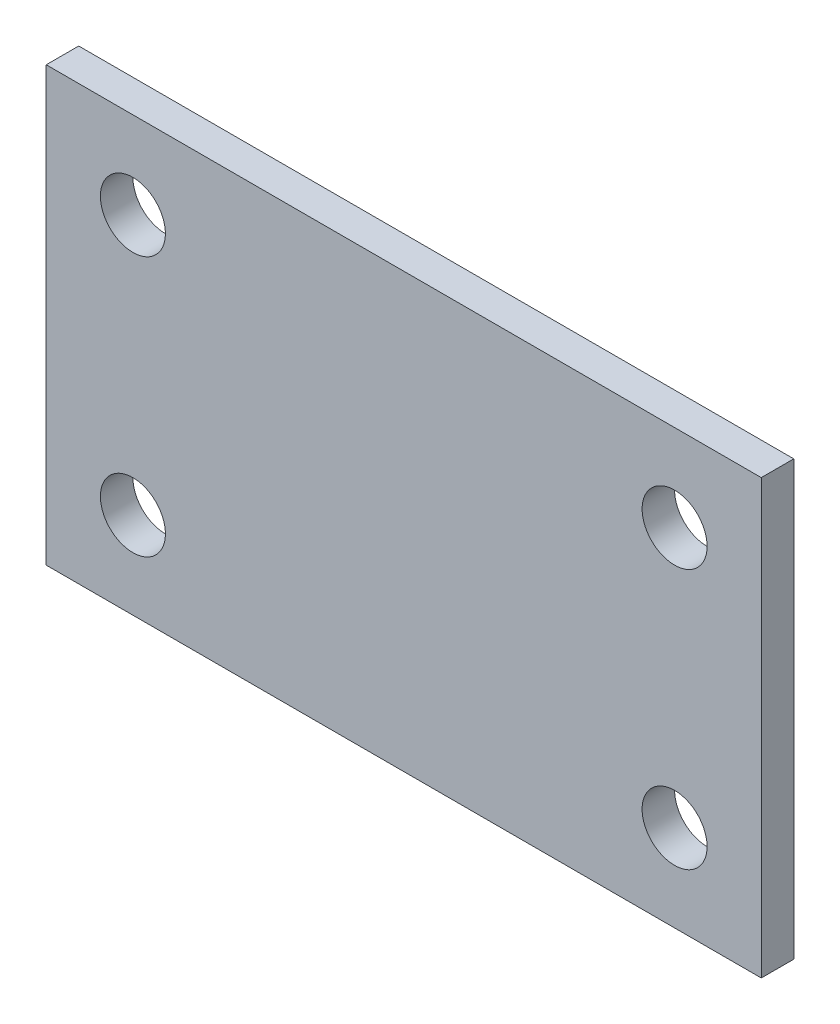
from build123d import *

# Parameters (mm, degrees)
SKETCH_1_W      = 66
SKETCH_1_H      = 40
SKETCH_1_R      = 3
EXTRUDE_1_DEPTH = 3


with BuildPart() as part:
    # 草图1 → 凸台-拉伸1 (new body)
    with BuildSketch(Plane.XY):
        Rectangle(SKETCH_1_W, SKETCH_1_H)
        with Locations((25, 12)):
            Circle(SKETCH_1_R, mode=Mode.SUBTRACT)
        with Locations((25, -12)):
            Circle(SKETCH_1_R, mode=Mode.SUBTRACT)
        with Locations(Location((-25, -12, 0), (0, 0, 180))):
            Circle(SKETCH_1_R, mode=Mode.SUBTRACT)
        with Locations(Location((-25, 12, 0), (0, 0, 180))):
            Circle(SKETCH_1_R, mode=Mode.SUBTRACT)
    extrude(amount=EXTRUDE_1_DEPTH)


solid = part.part
